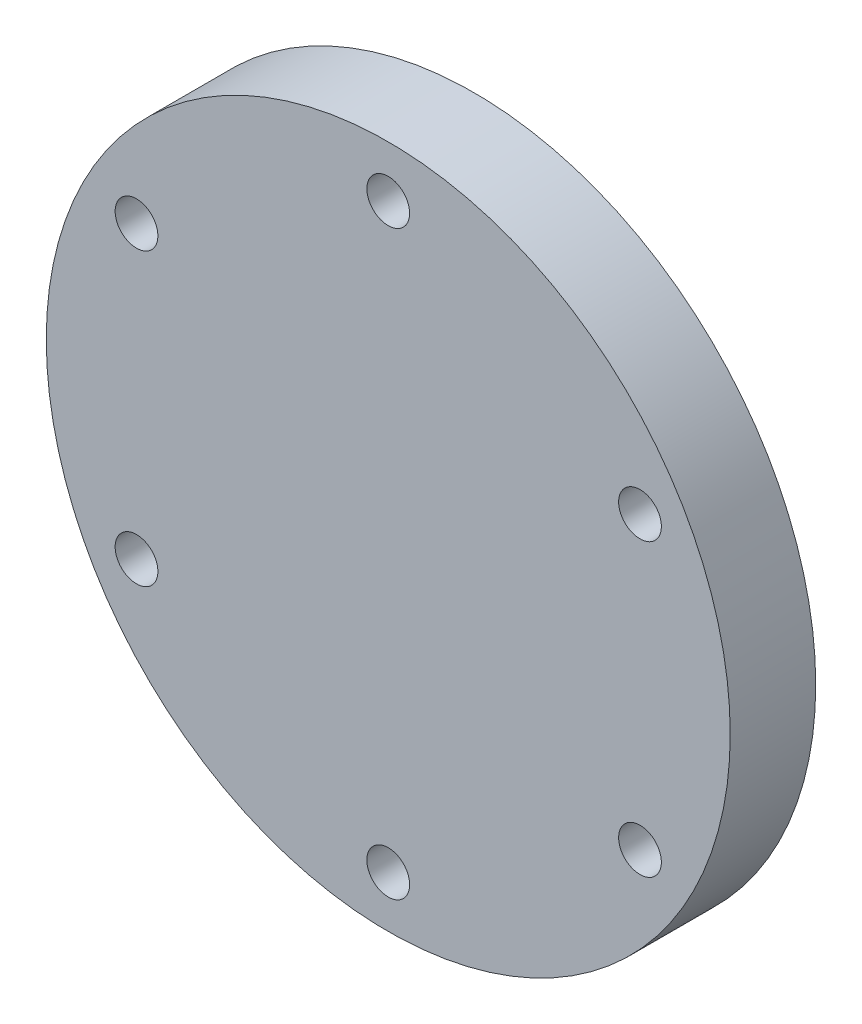
from build123d import *

# Parameters (mm, degrees)
SKETCH1_R           = 20
SKETCH1_R_2         = 1.25
BOSS_EXTRUDE1_DEPTH = 5


with BuildPart() as part:
    # Sketch1 → Boss-Extrude1 (new body)
    with BuildSketch(Plane.XY):
        Circle(SKETCH1_R)
        with Locations((0, 17)):
            Circle(SKETCH1_R_2, mode=Mode.SUBTRACT)
        with Locations((14.722431864, 8.5)):
            Circle(SKETCH1_R_2, mode=Mode.SUBTRACT)
        with Locations((14.722431864, -8.5)):
            Circle(SKETCH1_R_2, mode=Mode.SUBTRACT)
        with Locations((0, -17)):
            Circle(SKETCH1_R_2, mode=Mode.SUBTRACT)
        with Locations((-14.722431864, -8.5)):
            Circle(SKETCH1_R_2, mode=Mode.SUBTRACT)
        with Locations((-14.722431864, 8.5)):
            Circle(SKETCH1_R_2, mode=Mode.SUBTRACT)
    extrude(amount=BOSS_EXTRUDE1_DEPTH)


solid = part.part
